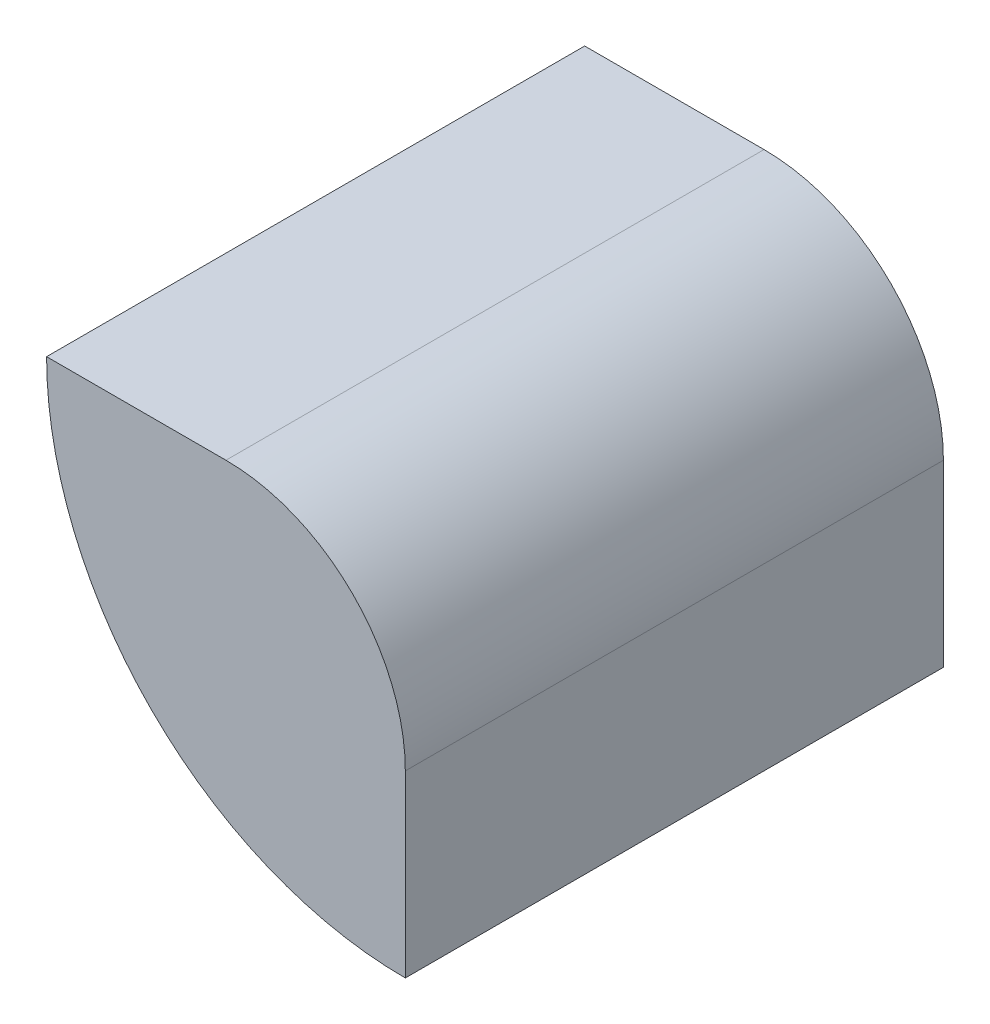
from build123d import *

# Parameters (mm, degrees)
RESSALTO_EXTRUS_O1_DEPTH = 15


with BuildPart() as part:
    # Esboço1 → Ressalto-extrusão1 (new body)
    with BuildSketch(Plane.XY):
        with BuildLine():
            Line((-43.336132643, -36.975355759), (-43.336132643, -31.975355759))
            ThreePointArc((-43.336132643, -31.975355759), (-44.800598738, -28.439821853), (-48.336132643, -26.975355759))
            Line((-48.336132643, -26.975355759), (-53.336132643, -26.975355759))
            ThreePointArc((-53.336132643, -26.975355759), (-50.407200455, -34.046423571), (-43.336132643, -36.975355759))
        make_face()
    extrude(amount=RESSALTO_EXTRUS_O1_DEPTH)


solid = part.part
